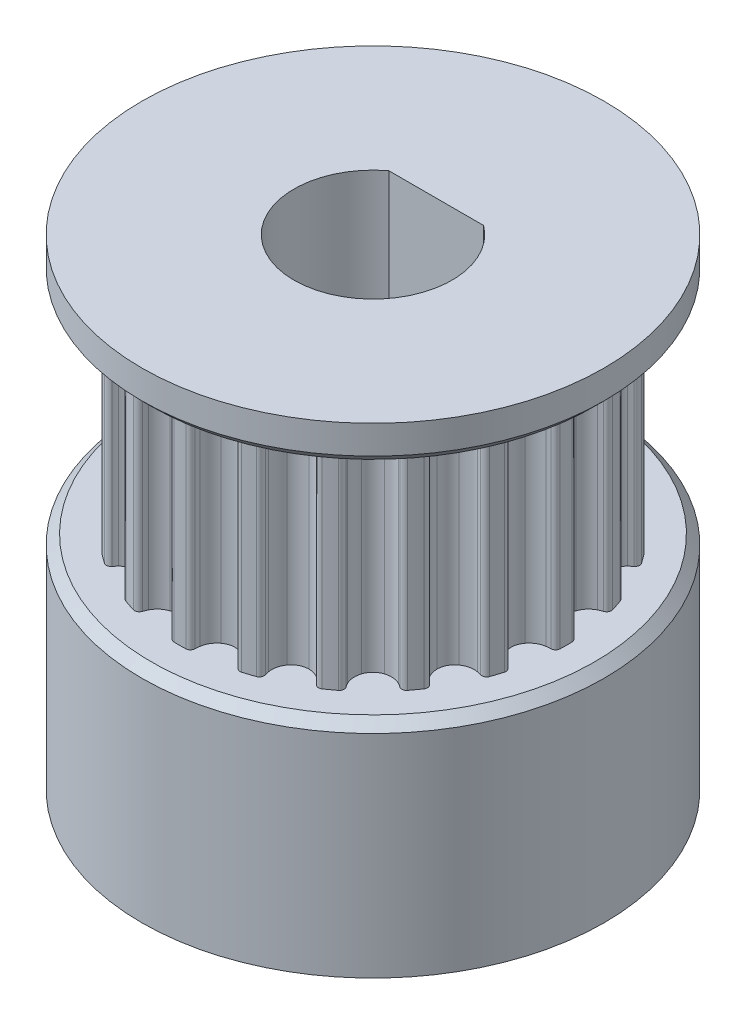
from build123d import *

# Parameters (mm, degrees)
BOSS_EXTRUDE1_DEPTH = 7
SKETCH2_R           = 5.362197724
BOSS_EXTRUDE2_DEPTH = 7
CIRPATTERN3_COUNT   = 20
SKETCH3_R           = 7.312197724
BOSS_EXTRUDE3_DEPTH = 1.2
BOSS_EXTRUDE4_START = 7
SKETCH4_R           = 7.312197724
BOSS_EXTRUDE4_DEPTH = 7
CUT_EXTRUDE1_DEPTH  = 19.384136398
CHAMFER1_SIZE       = 0.3


with BuildPart() as part:
    # Sketch1 → Boss-Extrude1 (new body)
    with BuildSketch(Plane(origin=(0, 0, 0), x_dir=(1, 0, 0), z_dir=(0, 1, 0))):
        with BuildLine():
            ThreePointArc((-0.838832532, 5.296180172), (-0.708843717, 5.333447554), (-0.591725856, 5.401044571))
            ThreePointArc((-0.591725856, 5.401044571), (-0.427411064, 5.584158965), (-0.344526118, 5.815805934))
            ThreePointArc((-0.344526118, 5.815805934), (-0.336322126, 5.887755805), (-0.333346558, 5.960110732))
            ThreePointArc((-0.333346558, 5.960110732), (-0.290777478, 6.064063067), (-0.187961119, 6.109306968))
            ThreePointArc((-0.187961119, 6.109306968), (0, 6.112197724), (0.187961119, 6.109306968))
            ThreePointArc((0.187961119, 6.109306968), (0.290777478, 6.064063067), (0.333346558, 5.960110732))
            ThreePointArc((0.333346558, 5.960110732), (0.336322126, 5.887755805), (0.344526118, 5.815805934))
            ThreePointArc((0.344526118, 5.815805934), (0.427411064, 5.584158965), (0.591725856, 5.401044571))
            ThreePointArc((0.591725856, 5.401044571), (0.708843717, 5.333447554), (0.838832532, 5.296180172))
            ThreePointArc((0.838832532, 5.296180172), (0, 5.362197724), (-0.838832532, 5.296180172))
        make_face()
    boss_extrude1 = extrude(amount=BOSS_EXTRUDE1_DEPTH)

    # Sketch2 → Boss-Extrude2 (add)
    with BuildSketch(Plane.XZ):
        Circle(SKETCH2_R)
        with BuildLine():
            ThreePointArc((-0.838832532, -5.296180172), (-0.708843717, -5.333447554), (-0.591725856, -5.401044571))
            ThreePointArc((-0.591725856, -5.401044571), (-0.427411064, -5.584158965), (-0.344526118, -5.815805934))
            ThreePointArc((-0.344526118, -5.815805934), (-0.336322126, -5.887755805), (-0.333346558, -5.960110732))
            ThreePointArc((-0.333346558, -5.960110732), (-0.290777478, -6.064063067), (-0.187961119, -6.109306968))
            ThreePointArc((-0.187961119, -6.109306968), (0, -6.112197724), (0.187961119, -6.109306968))
            ThreePointArc((0.187961119, -6.109306968), (0.290777478, -6.064063067), (0.333346558, -5.960110732))
            ThreePointArc((0.333346558, -5.960110732), (0.336322126, -5.887755805), (0.344526118, -5.815805934))
            ThreePointArc((0.344526118, -5.815805934), (0.427411064, -5.584158965), (0.591725856, -5.401044571))
            ThreePointArc((0.591725856, -5.401044571), (0.708843717, -5.333447554), (0.838832532, -5.296180172))
            ThreePointArc((0.838832532, -5.296180172), (0, -5.362197724), (-0.838832532, -5.296180172))
        make_face()
    extrude(amount=-BOSS_EXTRUDE2_DEPTH)

    # CirPattern3: Boss-Extrude1 ×20 about axis
    cirpattern3_axis = Axis((0, 0, 0), (0, 1, 0))
    for i in range(1, CIRPATTERN3_COUNT):
        add(boss_extrude1.rotate(cirpattern3_axis, i * 360 / CIRPATTERN3_COUNT))

    # Sketch3 → Boss-Extrude3 (add)
    with BuildSketch(Plane(origin=(0, 7, 0), x_dir=(1, 0, 0), z_dir=(0, 1, 0))):
        with Locations(Location((0, 0, 0), (0, 0, 270))):
            Circle(SKETCH3_R)
    extrude(amount=BOSS_EXTRUDE3_DEPTH)

    # Sketch4 → Boss-Extrude4 (add)
    with BuildSketch(Plane.XZ.offset(BOSS_EXTRUDE4_START)):
        with Locations(Location((0, 0, 0), (0, 0, 90))):
            Circle(SKETCH4_R)
    extrude(amount=-BOSS_EXTRUDE4_DEPTH)

    # Sketch5 → Cut-Extrude1 (cut, through all)
    with BuildSketch(Plane(origin=(0, 8.2, 0), x_dir=(1, 0, 0), z_dir=(0, 1, 0))):
        with BuildLine():
            Line((1.5, 2), (-1.5, 2))
            ThreePointArc((-1.5, 2), (-1.118033989, -2.236067977), (2.5, 0))
            ThreePointArc((2.5, 0), (2.236067977, 1.118033989), (1.5, 2))
        make_face()
    extrude(amount=-CUT_EXTRUDE1_DEPTH, mode=Mode.SUBTRACT)

    # Chamfer1
    chamfer1_edges = [part.edges().sort_by_distance(p)[0] for p in [
        (0, 7, -7.312197724),
        (0, 0, -7.312197724),
    ]]
    chamfer(chamfer1_edges, length=CHAMFER1_SIZE)


solid = part.part
